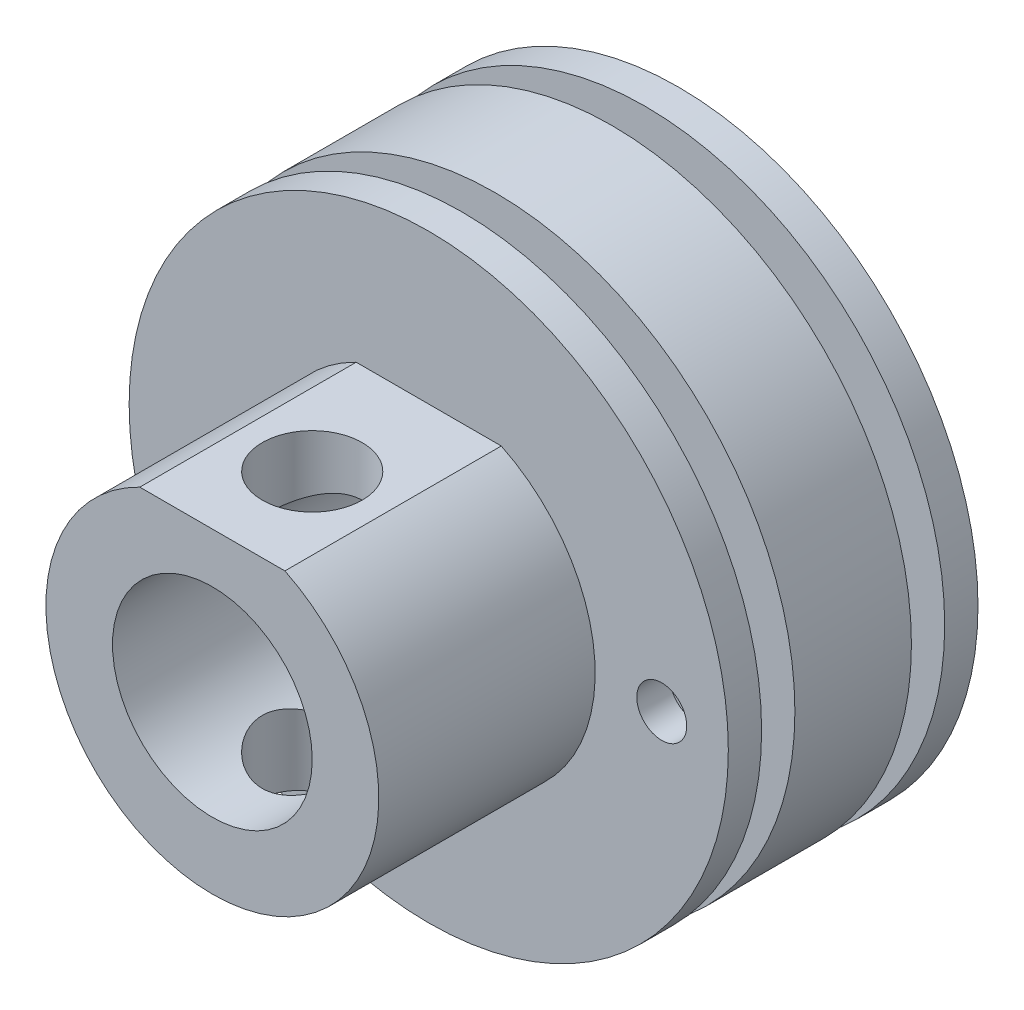
from build123d import *

# Parameters (mm, degrees)
SKETCH_1_R               = 9
EXTRUDE_1_DEPTH          = 7.5
SKETCH_2_R               = 5
EXTRUDE_2_DEPTH          = 6.5
SKETCH_3_R               = 3
CUT_EXTRUDE_1_DEPTH      = 19.920887928
CUT_EXTRUDE_2_DEPTH      = 19.920887928
CUT_EXTRUDE_2_DEPTH_BACK = 19.920887928
SKETCH_4_R               = 1.5
SKETCH_5_W               = 4
SKETCH_5_H               = 1
SKETCH_6_R               = 0.75
CUT_EXTRUDE_3_DEPTH      = 10
CUT_EXTRUDE_4_DEPTH      = 19.920888002
CUT_EXTRUDE_4_DEPTH_BACK = 19.920888002
SKETCH_8_W               = 6.5
SKETCH_8_H               = 0.5


with BuildPart() as part:
    # 草图1 → 凸台-拉伸1 (new body)
    with BuildSketch(Plane.XY):
        Circle(SKETCH_1_R)
    extrude(amount=EXTRUDE_1_DEPTH)

    # 草图2 → 凸台-拉伸2 (add)
    with BuildSketch(Plane.XY.offset(7.5)):
        with Locations(Location((0, 0, 0), (0, 0, 180))):
            Circle(SKETCH_2_R)
    extrude(amount=EXTRUDE_2_DEPTH)

    # 草图3 → 切除-拉伸1 (cut, through all)
    with BuildSketch(Plane.XY.offset(14)):
        Circle(SKETCH_3_R)
    extrude(amount=-CUT_EXTRUDE_1_DEPTH, mode=Mode.SUBTRACT)

    # 草图4 → 切除-拉伸2 (cut, two sides: drawn at the far end of the back side and taken through both)
    with BuildSketch(Plane(origin=(0, 0, 0), x_dir=(1, 0, 0), z_dir=(0, 1, 0)).offset(-CUT_EXTRUDE_2_DEPTH_BACK)):
        with Locations(Location((0, -11, 0), (0, 0, 270))):
            Circle(SKETCH_4_R)
    extrude(amount=CUT_EXTRUDE_2_DEPTH + CUT_EXTRUDE_2_DEPTH_BACK, mode=Mode.SUBTRACT)

    # 草图5 → 切除-旋转1 (revolve, cut)
    with BuildSketch(Plane(origin=(0, 0, 0), x_dir=(1, 0, 0), z_dir=(0, 1, 0)), mode=Mode.PRIVATE) as cut_revolve_1_sk:
        with Locations((7, -1.5)):
            Rectangle(SKETCH_5_W, SKETCH_5_H)
        with Locations((7, -6)):
            Rectangle(SKETCH_5_W, SKETCH_5_H)
    revolve(cut_revolve_1_sk.sketch.rotate(Axis((0, 0, -0.802981009), (0, 0, 1)), 180), axis=Axis((0, 0, -0.802981009), (0, 0, 1)), mode=Mode.SUBTRACT)

    # 草图6 → 切除-拉伸3 (cut)
    with BuildSketch(Plane.XY.offset(7.5)):
        with Locations((7, 0)):
            Circle(SKETCH_6_R)
    extrude(amount=-CUT_EXTRUDE_3_DEPTH, mode=Mode.SUBTRACT)

    # 草图8 → 切除-拉伸4 (cut, two sides: drawn at the far end of the back side and taken through both)
    with BuildSketch(Plane(origin=(0, 0, 0), x_dir=(0, 0, -1), z_dir=(1, 0, 0)).offset(-CUT_EXTRUDE_4_DEPTH_BACK)):
        with Locations((-10.75, 4.75)):
            Rectangle(SKETCH_8_W, SKETCH_8_H)
    extrude(amount=CUT_EXTRUDE_4_DEPTH + CUT_EXTRUDE_4_DEPTH_BACK, mode=Mode.SUBTRACT)


solid = part.part
